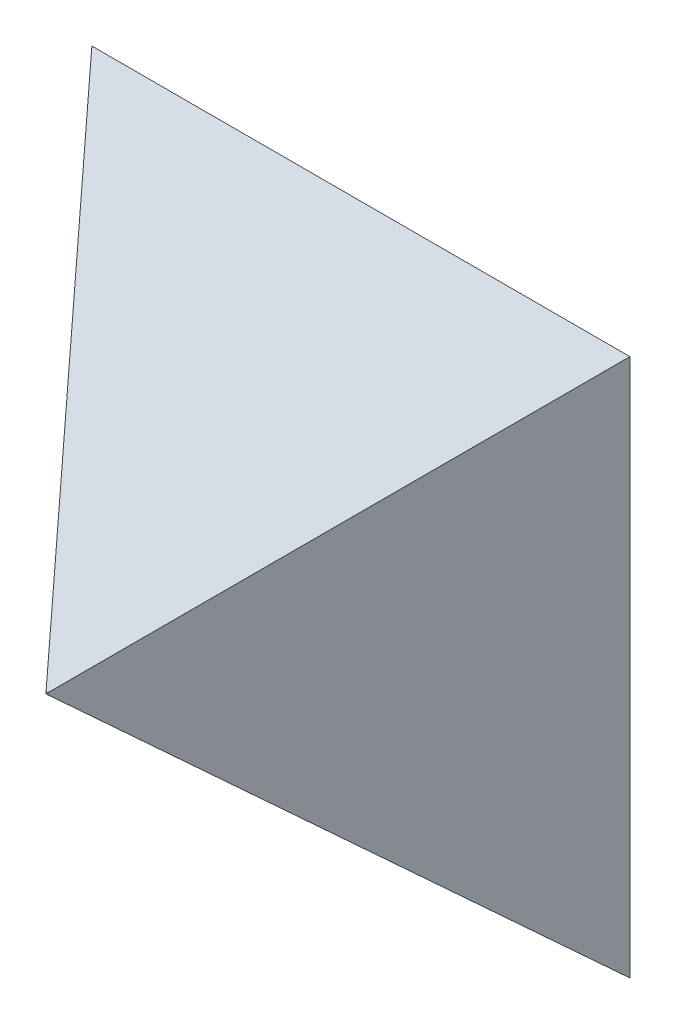
from build123d import *

# Parameters (mm, degrees)
ESQUISSE1_W             = 25.4
ESQUISSE1_H             = 25.4
BOSS_EXTRU_1_DEPTH      = 14.81582
BOSS_EXTRU_1_TAPER      = 40.5
ESQUISSE2_R             = 1.666875
ENL_V_MAT_EXTRU_1_DEPTH = 12.7


with BuildPart() as part:
    # Esquisse1 → Boss.-Extru.1 (new body)
    with BuildSketch(Plane.XY):
        Rectangle(ESQUISSE1_W, ESQUISSE1_H)
    extrude(amount=BOSS_EXTRU_1_DEPTH, taper=BOSS_EXTRU_1_TAPER)

    # Esquisse2 → Enlèv. mat.-Extru.1 (cut)
    with BuildSketch(Plane(origin=(0, -12.7, 0), x_dir=(1, 0, 0), z_dir=(0, 1, 0))):
        with Locations(Location((0, -7.40791, 0), (0, 0, 90))):
            Circle(ESQUISSE2_R)
    extrude(amount=ENL_V_MAT_EXTRU_1_DEPTH, mode=Mode.SUBTRACT)


solid = part.part
